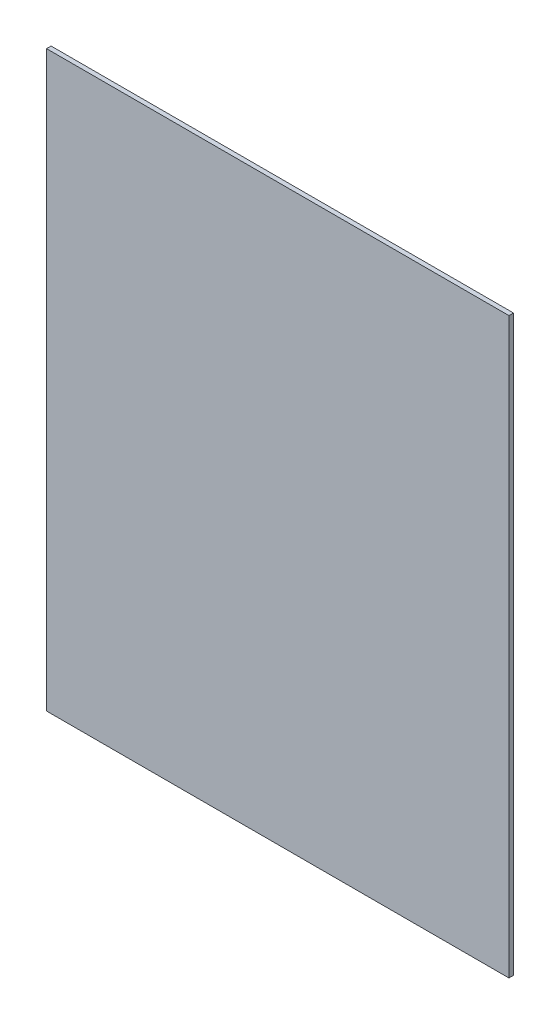
from build123d import *

# Parameters (mm, degrees)
SKETCH_1_W      = 51
SKETCH_1_H      = 63.27
EXTRUDE_1_DEPTH = 0.5


with BuildPart() as part:
    # ｽｹｯﾁ1 → ﾎﾞｽ - 押し出し1 (new body)
    with BuildSketch(Plane.XY):
        Rectangle(SKETCH_1_W, SKETCH_1_H)
    extrude(amount=EXTRUDE_1_DEPTH)


solid = part.part
